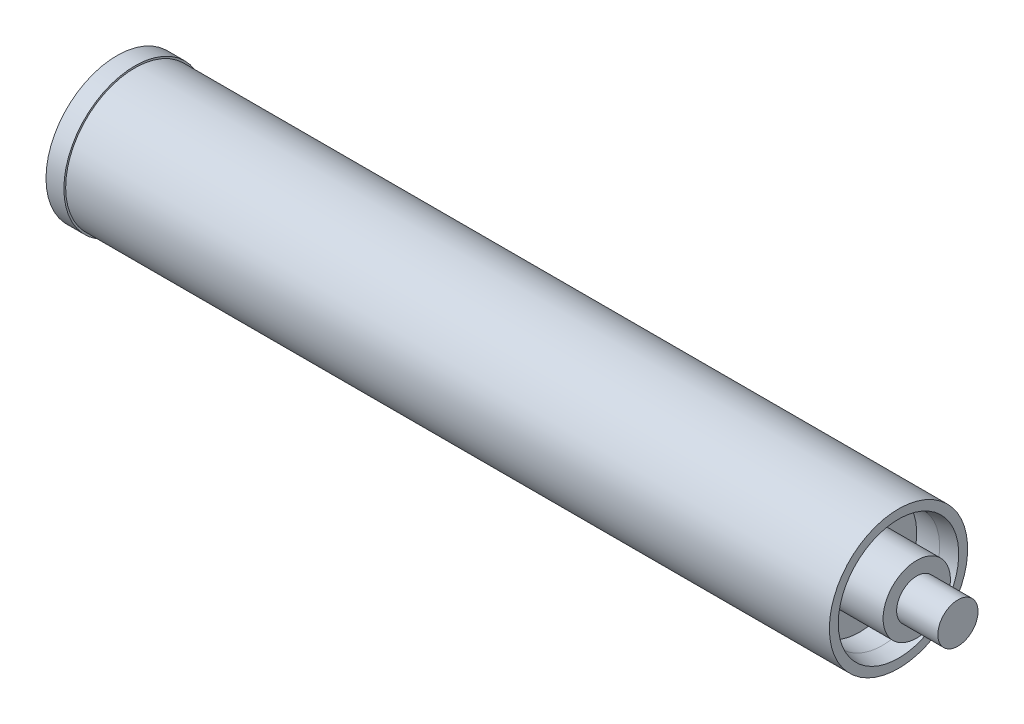
from build123d import *


with BuildPart() as part:
    # Esquisse2 → Révolution7 (revolve)
    with BuildSketch(Plane.XY, mode=Mode.PRIVATE) as r_volution7_sk:
        Polygon((0, 26), (12.7, 26), (36.56741584, 26), (36.56741584, 35.689138439), (25.4, 35.689138439), (12.7, 38.2095), (12.7, 50.419), (25.4, 50.419), (25.4, 49.149), (568.32, 49.149), (568.32, 42.820187711), (556.99714835, 40.573126289), (540.71, 40.573126289), (540.71, 23.9395), (581.28, 23.9395), (581.28, 14.2875), (610.57, 14.2875), (610.57, 0), (0, 0), align=None)
    revolve(r_volution7_sk.sketch.rotate(Axis((0, 0, 0), (1, 0, 0)), 90), axis=Axis((0, 0, 0), (1, 0, 0)))

    # Esquisse3 → Enlèvement de matière-Révolution1 (revolve, cut)
    with BuildSketch(Plane.XY, mode=Mode.PRIVATE) as enl_vement_de_mati_re_r_volution1_sk:
        Polygon((0, 20), (0, 0), (540.71, 0), (540.71, 12.957757221), (381.061065959, 12.957757221), (381.061065959, 44.271024873), (65.871878934, 44.271024873), (34.08300614, 14.327580407), (19.08300614, 14.327580407), align=None)
    revolve(enl_vement_de_mati_re_r_volution1_sk.sketch.rotate(Axis((0, 0, 0), (1, 0, 0)), 90), axis=Axis((0, 0, 0), (1, 0, 0)), mode=Mode.SUBTRACT)


solid = part.part
